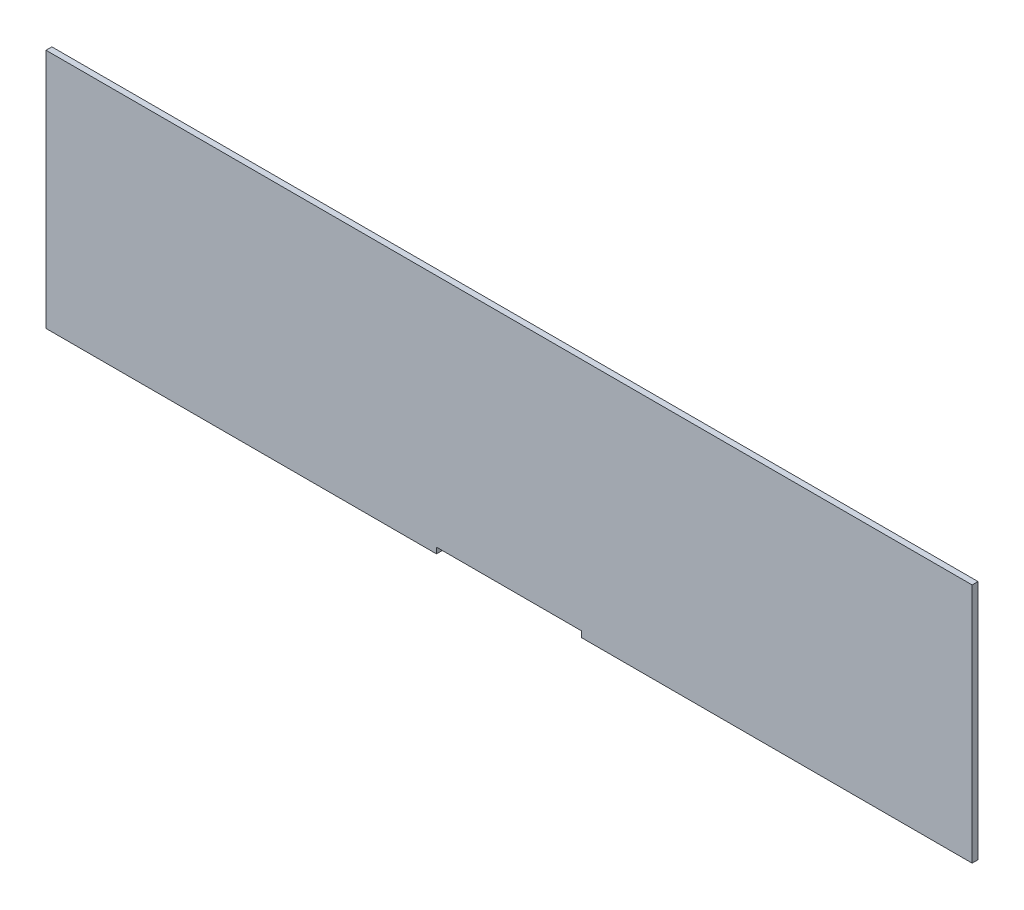
from build123d import *

# Parameters (mm, degrees)
BOSS_EXTRUDE1_DEPTH = 3


with BuildPart() as part:
    # Sketch1 → Boss-Extrude1 (new body)
    with BuildSketch(Plane.XY):
        Polygon((-37.055, 3), (37.055, 3), (37.055, 0), (236.355, 0), (236.355, 123), (-236.355, 123), (-236.355, 0), (-37.055, 0), align=None)
    extrude(amount=BOSS_EXTRUDE1_DEPTH)


solid = part.part
